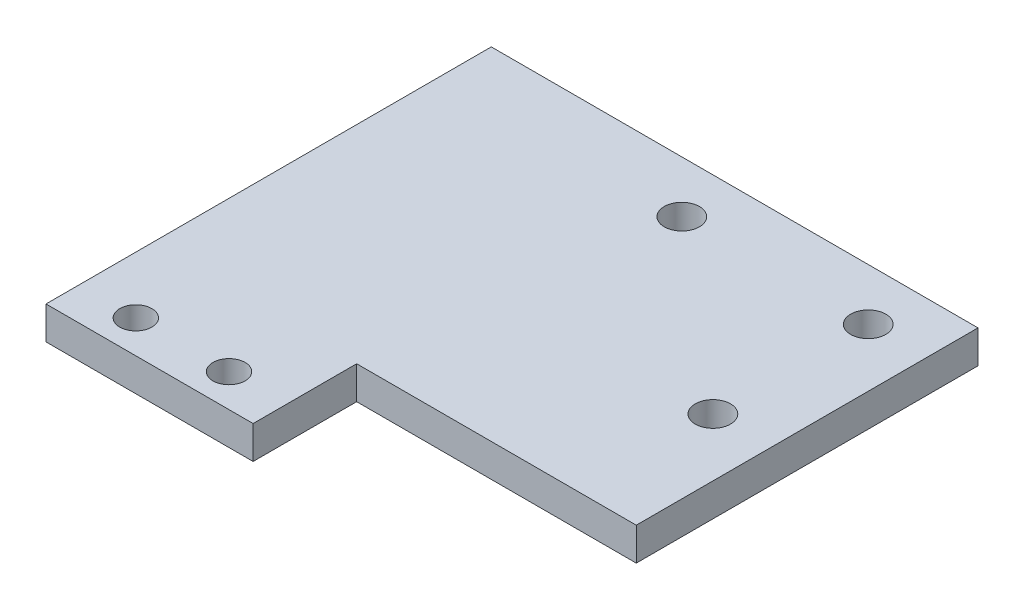
from build123d import *

# Parameters (mm, degrees)
SKETCH1_R           = 1.55
SKETCH1_R_2         = 1.7
BOSS_EXTRUDE1_DEPTH = 3.175


with BuildPart() as part:
    # Sketch1 → Boss-Extrude1 (new body)
    with BuildSketch(Plane(origin=(0, 0, 0), x_dir=(1, 0, 0), z_dir=(0, 1, 0))):
        Polygon((0, 0), (0, 43), (47, 43), (47, 10), (20, 10), (20, 0), align=None)
        with Locations(Location((14.5, 3.175, 0), (0, 0, 270))):
            Circle(SKETCH1_R, mode=Mode.SUBTRACT)
        with Locations(Location((5.5, 3.175, 0), (0, 0, 270))):
            Circle(SKETCH1_R, mode=Mode.SUBTRACT)
        with Locations(Location((41.4, 23, 0), (0, 0, 270))):
            Circle(SKETCH1_R_2, mode=Mode.SUBTRACT)
        with Locations(Location((41.4, 38, 0), (0, 0, 270))):
            Circle(SKETCH1_R_2, mode=Mode.SUBTRACT)
        with Locations(Location((23.4, 38, 0), (0, 0, 270))):
            Circle(SKETCH1_R_2, mode=Mode.SUBTRACT)
    extrude(amount=BOSS_EXTRUDE1_DEPTH)


solid = part.part
